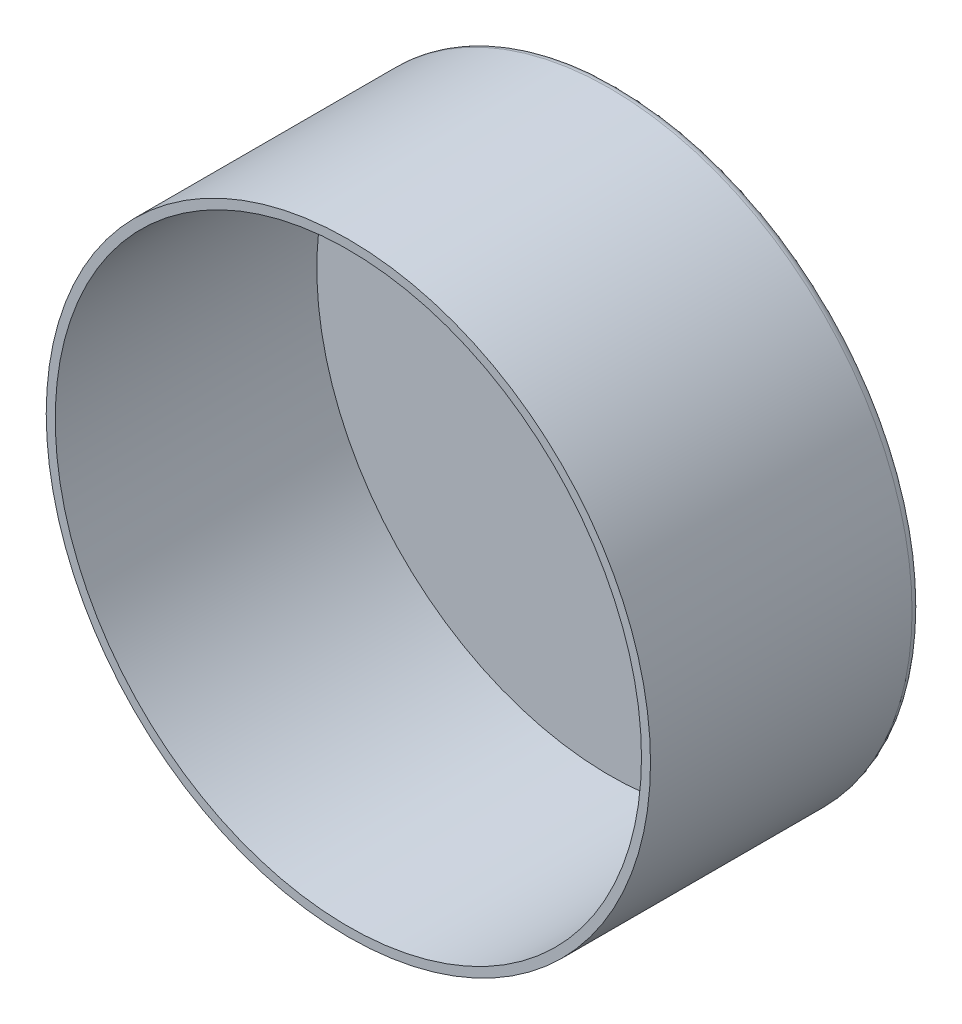
from build123d import *

# Parameters (mm, degrees)
SKETCH1_R           = 16.75
BOSS_EXTRUDE1_DEPTH = 15
SHELL2_T            = -0.5
FILLET1_R           = 0.5


with BuildPart() as part:
    # Sketch1 → Boss-Extrude1 (new body)
    with BuildSketch(Plane.XY):
        Circle(SKETCH1_R)
    extrude(amount=BOSS_EXTRUDE1_DEPTH)

    # Shell2
    shell2_openings = [part.faces().sort_by_distance(p)[0] for p in [
        (0, 0, 15),
    ]]
    offset(amount=SHELL2_T, openings=shell2_openings, kind=Kind.INTERSECTION)

    # Fillet1
    fillet1_edges = [part.edges().sort_by_distance(p)[0] for p in [
        (-16.75, 0, 0),
    ]]
    fillet(fillet1_edges, radius=FILLET1_R)


solid = part.part
